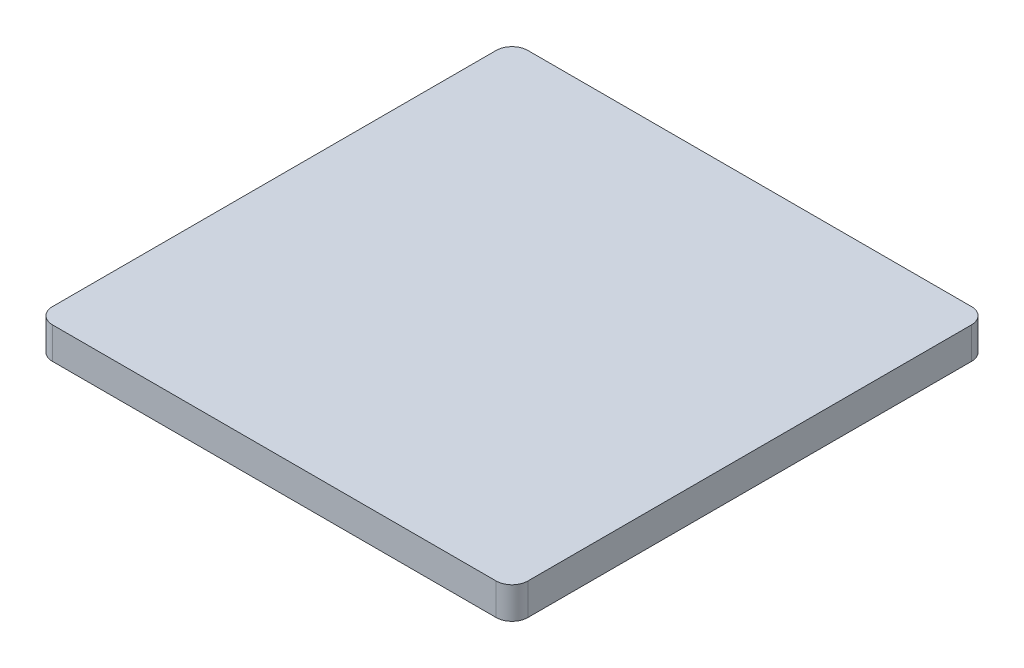
from build123d import *

# Parameters (mm, degrees)
CROQUIS1_W     = 30
CROQUIS1_H     = 30
EXTRUIR1_DEPTH = 2
REDONDEO1_R    = 1


with BuildPart() as part:
    # Croquis1 → Extruir1 (new body)
    with BuildSketch(Plane(origin=(0, 0, 0), x_dir=(1, 0, 0), z_dir=(0, 1, 0))):
        Rectangle(CROQUIS1_W, CROQUIS1_H)
    extrude(amount=EXTRUIR1_DEPTH)

    # Redondeo1
    redondeo1_edges = [part.edges().sort_by_distance(p)[0] for p in [
        (-15, 1, -15),
        (15, 1, -15),
        (15, 1, 15),
        (-15, 1, 15),
    ]]
    fillet(redondeo1_edges, radius=REDONDEO1_R)


solid = part.part
